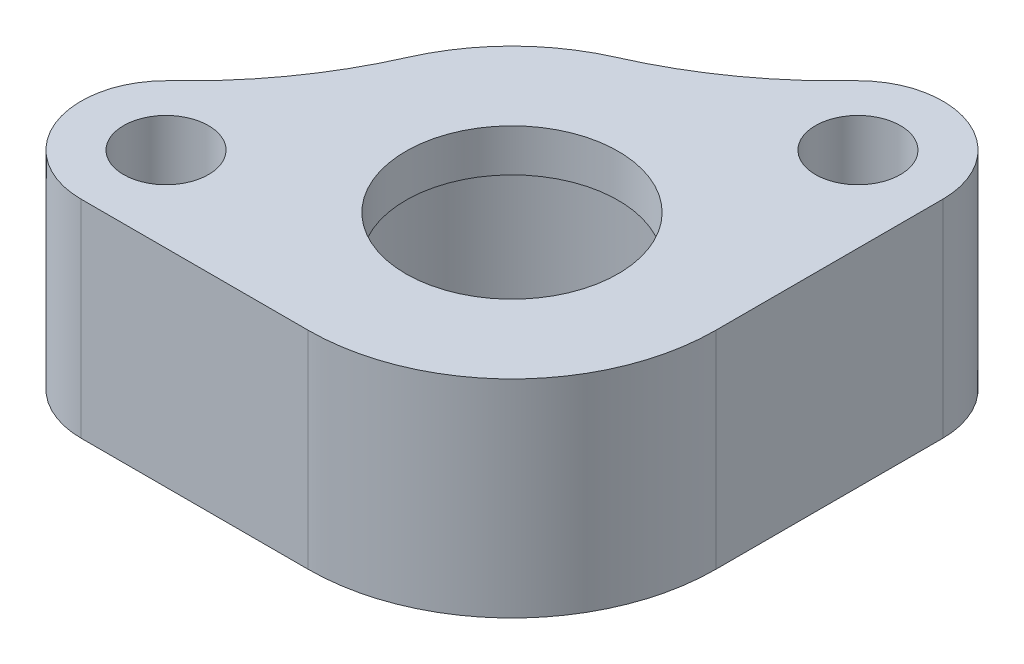
from build123d import *

# Parameters (mm, degrees)
SKETCH1_R           = 2
SKETCH1_R_2         = 7.6
BOSS_EXTRUDE1_DEPTH = 7.75
SKETCH2_R           = 2
SKETCH2_R_2         = 5
BOSS_EXTRUDE2_DEPTH = 2
FILLET1_R           = 20


with BuildPart() as part:
    # Sketch1 → Boss-Extrude1 (new body)
    with BuildSketch(Plane(origin=(0, 0, 0), x_dir=(1, 0, 0), z_dir=(0, 1, 0))):
        with BuildLine():
            Line((2.771572875, 13.519595949), (-1.226723266, 9.521299808))
            ThreePointArc((-1.226723266, 9.521299808), (-6.788225099, 6.788225099), (-9.521299808, 1.226723266))
            Line((-9.521299808, 1.226723266), (-13.519595949, -2.771572875))
            ThreePointArc((-13.519595949, -2.771572875), (-14.386686955, -7.130733729), (-10.691168825, -9.6))
            Line((-10.691168825, -9.6), (0, -9.6))
            ThreePointArc((0, -9.6), (6.788225099, -6.788225099), (9.6, 0))
            Line((9.6, 0), (9.6, 10.691168825))
            ThreePointArc((9.6, 10.691168825), (7.130733729, 14.386686955), (2.771572875, 13.519595949))
        make_face()
        with Locations(Location((-10.691168825, -5.6, 0), (0, 0, 270))):
            Circle(SKETCH1_R, mode=Mode.SUBTRACT)
        with Locations(Location((0, 0, 0), (0, 0, 270))):
            Circle(SKETCH1_R_2, mode=Mode.SUBTRACT)
        with Locations(Location((5.6, 10.691168825, 0), (0, 0, 270))):
            Circle(SKETCH1_R, mode=Mode.SUBTRACT)
    extrude(amount=BOSS_EXTRUDE1_DEPTH)

    # Sketch2 → Boss-Extrude2 (add)
    with BuildSketch(Plane(origin=(0, 7.75, 0), x_dir=(1, 0, 0), z_dir=(0, 1, 0))):
        with BuildLine():
            Line((9.6, 0), (9.6, 10.691168825))
            ThreePointArc((9.6, 10.691168825), (7.130733729, 14.386686955), (2.771572875, 13.519595949))
            Line((2.771572875, 13.519595949), (-1.226723266, 9.521299808))
            ThreePointArc((-1.226723266, 9.521299808), (-6.788225099, 6.788225099), (-9.521299808, 1.226723266))
            Line((-9.521299808, 1.226723266), (-13.519595949, -2.771572875))
            ThreePointArc((-13.519595949, -2.771572875), (-14.386686955, -7.130733729), (-10.691168825, -9.6))
            Line((-10.691168825, -9.6), (0, -9.6))
            ThreePointArc((0, -9.6), (6.788225099, -6.788225099), (9.6, 0))
        make_face()
        with Locations(Location((-10.691168825, -5.6, 0), (0, 0, 270))):
            Circle(SKETCH2_R, mode=Mode.SUBTRACT)
        with Locations(Location((5.6, 10.691168825, 0), (0, 0, 270))):
            Circle(SKETCH2_R, mode=Mode.SUBTRACT)
        with Locations(Location((0, 0, 0), (0, 0, 270))):
            Circle(SKETCH2_R_2, mode=Mode.SUBTRACT)
    extrude(amount=BOSS_EXTRUDE2_DEPTH)

    # Fillet1
    fillet1_edges = [part.edges().sort_by_distance(p)[0] for p in [
        (-9.521299808, 4.875, -1.226723266),
        (-1.226723266, 4.875, -9.521299808),
    ]]
    fillet(fillet1_edges, radius=FILLET1_R)


solid = part.part
